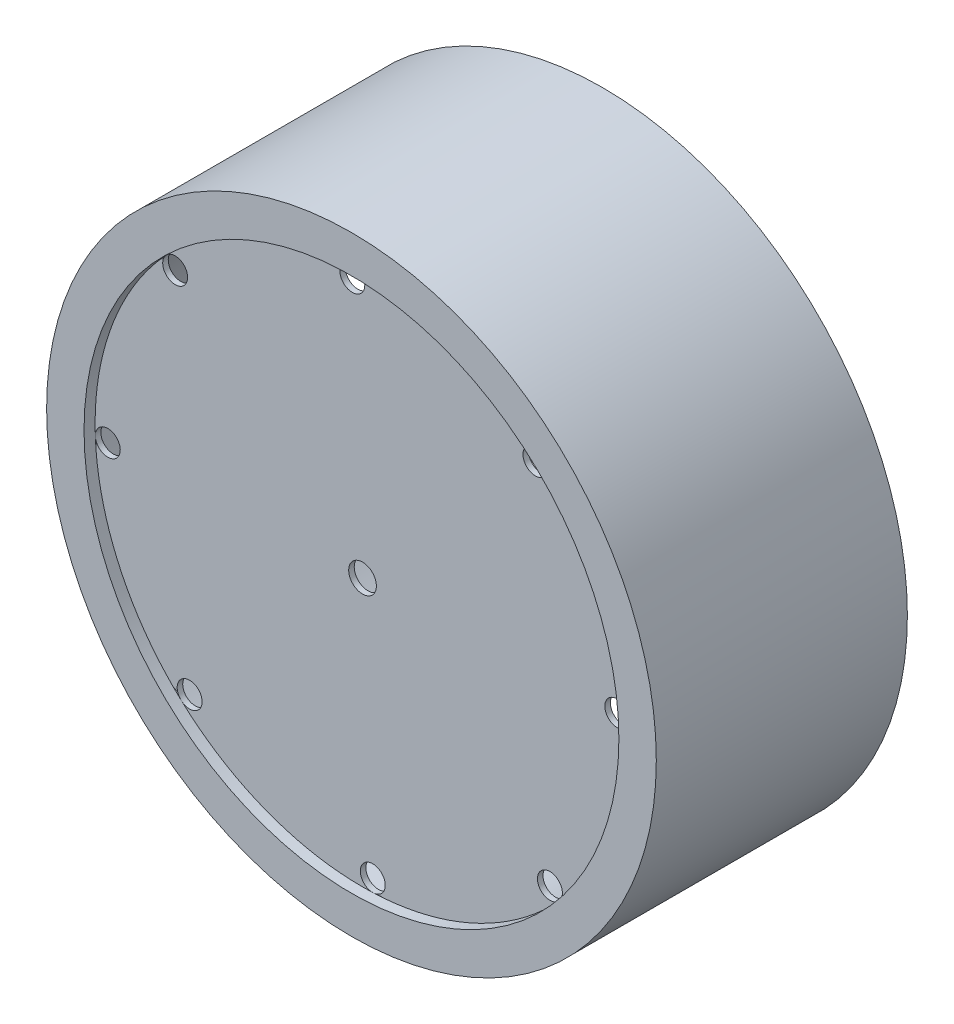
from build123d import *

# Parameters (mm, degrees)
SKETCH_1_R          = 55
EXTRUDE_3_DEPTH     = 45.3
SKETCH_5_R          = 50
CUT_EXTRUDE_3_DEPTH = 42.3
SKETCH_8_R          = 48.25
CUT_EXTRUDE_4_DEPTH = 2
SKETCH_6_R          = 2.25
CUT_EXTRUDE_6_DEPTH = 2
SKETCH_10_R         = 2.5
CUT_EXTRUDE_7_DEPTH = 5


with BuildPart() as part:
    # 草图1 → 凸台-拉伸3 (new body)
    with BuildSketch(Plane.XY):
        Circle(SKETCH_1_R)
    extrude(amount=EXTRUDE_3_DEPTH)

    # 草图5 → 切除-拉伸3 (cut)
    with BuildSketch(Plane(origin=(0, 0, 0), x_dir=(-1, 0, 0), z_dir=(0, 0, -1))):
        Circle(SKETCH_5_R)
    extrude(amount=-CUT_EXTRUDE_3_DEPTH, mode=Mode.SUBTRACT)

    # 草图8 → 切除-拉伸4 (cut)
    with BuildSketch(Plane.XY.offset(45.3)):
        Circle(SKETCH_8_R)
    extrude(amount=-CUT_EXTRUDE_4_DEPTH, mode=Mode.SUBTRACT)

    # 草图6 → 切除-拉伸6 (cut)
    with BuildSketch(Plane(origin=(0, 0, 42.3), x_dir=(-1, 0, 0), z_dir=(0, 0, -1))):
        with Locations((31.194195936, -33.807131495)):
            Circle(SKETCH_6_R)
        with Locations((-1.847624453, -45.962879412)):
            Circle(SKETCH_6_R)
        with Locations((-33.807131495, -31.194195936)):
            Circle(SKETCH_6_R)
        with Locations((-45.962879412, 1.847624453)):
            Circle(SKETCH_6_R)
        with Locations((-31.194195936, 33.807131495)):
            Circle(SKETCH_6_R)
        with Locations((1.847624453, 45.962879412)):
            Circle(SKETCH_6_R)
        with Locations((33.807131495, 31.194195936)):
            Circle(SKETCH_6_R)
        with Locations((45.962879412, -1.847624453)):
            Circle(SKETCH_6_R)
    extrude(amount=-CUT_EXTRUDE_6_DEPTH, mode=Mode.SUBTRACT)

    # 草图10 → 切除-拉伸7 (cut)
    with BuildSketch(Plane(origin=(0, 0, 42.3), x_dir=(-1, 0, 0), z_dir=(0, 0, -1))):
        Circle(SKETCH_10_R)
    extrude(amount=-CUT_EXTRUDE_7_DEPTH, mode=Mode.SUBTRACT)


solid = part.part
